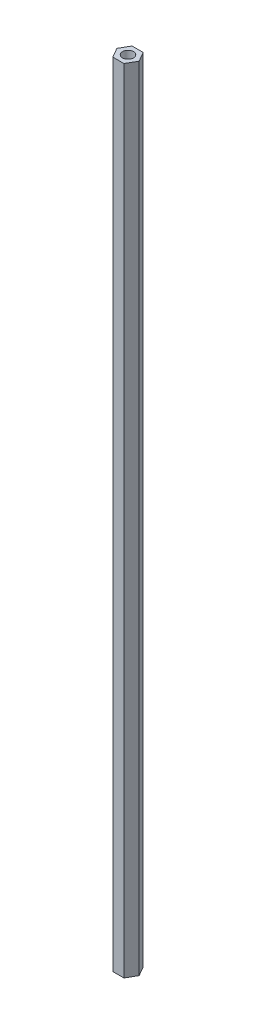
from build123d import *

# Parameters (mm, degrees)
SKETCH1_R           = 2
BOSS_EXTRUDE1_DEPTH = 288


with BuildPart() as part:
    # Sketch1 → Boss-Extrude1 (new body)
    with BuildSketch(Plane(origin=(0, 0, 0), x_dir=(1, 0, 0), z_dir=(0, 1, 0))):
        Polygon((2.020725942, 3.5), (-2.020725942, 3.5), (-4.041451884, 0), (-2.020725942, -3.5), (2.020725942, -3.5), (4.041451884, 0), align=None)
        with Locations(Location((0, 0, 0), (0, 0, 270))):
            Circle(SKETCH1_R, mode=Mode.SUBTRACT)
    extrude(amount=BOSS_EXTRUDE1_DEPTH)


solid = part.part
